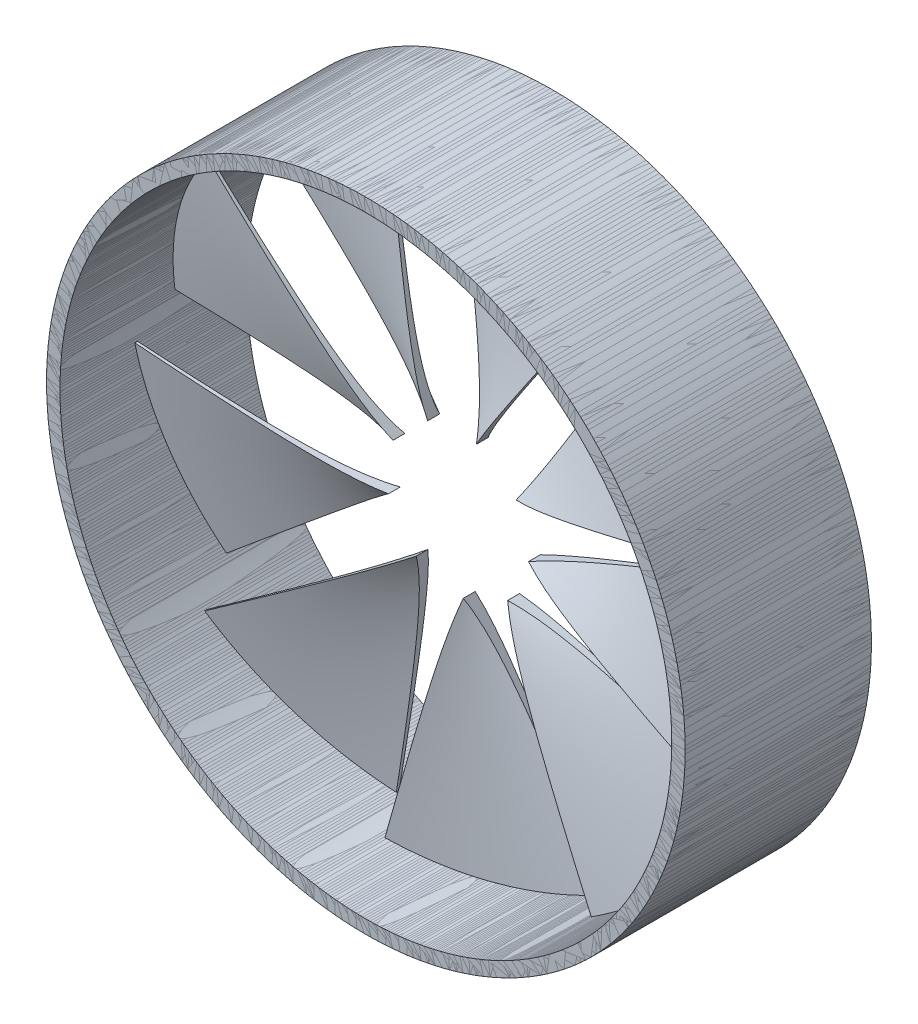
from build123d import *

# Parameters (mm, degrees)
SWEEP1_PITCH             = 150
SWEEP1_HEIGHT            = 30
SWEEP1_RADIUS            = 119.994
SWEEP1_START_ANGLE       = -180
SKETCH2_W                = 94.794
SKETCH2_H                = 5
SKETCH9_OUTSIDE_W        = 152.404
SKETCH9_OUTSIDE_H        = 151.108
CUT_EXTRUDE1_DEPTH       = 40
BOSS_EXTRUDE1_DEPTH      = 45
BOSS_EXTRUDE1_DEPTH_BACK = 25
SKETCH10_R               = 119.994
SKETCH10_R_2             = 114.994
CIRPATTERN2_COUNT        = 9


with BuildPart() as part:
    # Sweep1: sweep along a helix
    with BuildLine() as sweep1_path:
        add(Helix(SWEEP1_PITCH, SWEEP1_HEIGHT, SWEEP1_RADIUS, center=(0, 0, 0), direction=(0, 0, 1), lefthand=True, mode=Mode.PRIVATE).rotate(Axis((0, 0, 0), (0, 0, 1)), SWEEP1_START_ANGLE))
    # Sketch2 → Sweep1 (sweep)
    with BuildSketch(Plane.XY):
        with Locations((-72.597, 2.5)):
            Rectangle(SKETCH2_W, SKETCH2_H)
    sweep(path=sweep1_path.line, is_frenet=True)

    # Sketch9 outside → Cut-Extrude1 (cut)
    with BuildSketch(Plane.XY):
        with Locations((-61.513, 57.833)):
            Rectangle(SKETCH9_OUTSIDE_W, SKETCH9_OUTSIDE_H)
        with BuildLine():
            Line((-24.229160317, 11.483730491), (-90.971702523, 78.226272697))
            ThreePointArc((-90.971702523, 78.226272697), (-110.366537075, 47.057708125), (-119.429160317, 11.483730491))
            Line((-119.429160317, 11.483730491), (-24.229160317, 11.483730491))
        make_face(mode=Mode.SUBTRACT)
    extrude(amount=CUT_EXTRUDE1_DEPTH, mode=Mode.SUBTRACT)

    # Sketch10 → Boss-Extrude1 (add, two sides: drawn at the far end of the back side and taken through both)
    with BuildSketch(Plane.XY.offset(-BOSS_EXTRUDE1_DEPTH_BACK)):
        Circle(SKETCH10_R)
        Circle(SKETCH10_R_2, mode=Mode.SUBTRACT)
    extrude(amount=BOSS_EXTRUDE1_DEPTH + BOSS_EXTRUDE1_DEPTH_BACK)


with BuildPart() as cirpattern2_1:
    # CirPattern2: pattern copy
    add(part.part.rotate(Axis((0, 0, -25), (0, 0, 1)), 1 * 360 / CIRPATTERN2_COUNT))


with BuildPart() as cirpattern2_2:
    # CirPattern2: pattern copy
    add(part.part.rotate(Axis((0, 0, -25), (0, 0, 1)), 2 * 360 / CIRPATTERN2_COUNT))


with BuildPart() as cirpattern2_3:
    # CirPattern2: pattern copy
    add(part.part.rotate(Axis((0, 0, -25), (0, 0, 1)), 3 * 360 / CIRPATTERN2_COUNT))


with BuildPart() as cirpattern2_4:
    # CirPattern2: pattern copy
    add(part.part.rotate(Axis((0, 0, -25), (0, 0, 1)), 4 * 360 / CIRPATTERN2_COUNT))


with BuildPart() as cirpattern2_5:
    # CirPattern2: pattern copy
    add(part.part.rotate(Axis((0, 0, -25), (0, 0, 1)), 5 * 360 / CIRPATTERN2_COUNT))


with BuildPart() as cirpattern2_6:
    # CirPattern2: pattern copy
    add(part.part.rotate(Axis((0, 0, -25), (0, 0, 1)), 6 * 360 / CIRPATTERN2_COUNT))


with BuildPart() as cirpattern2_7:
    # CirPattern2: pattern copy
    add(part.part.rotate(Axis((0, 0, -25), (0, 0, 1)), 7 * 360 / CIRPATTERN2_COUNT))


with BuildPart() as cirpattern2_8:
    # CirPattern2: pattern copy
    add(part.part.rotate(Axis((0, 0, -25), (0, 0, 1)), 8 * 360 / CIRPATTERN2_COUNT))


solid = Compound([part.part, cirpattern2_1.part, cirpattern2_2.part, cirpattern2_3.part, cirpattern2_4.part, cirpattern2_5.part, cirpattern2_6.part, cirpattern2_7.part, cirpattern2_8.part])
